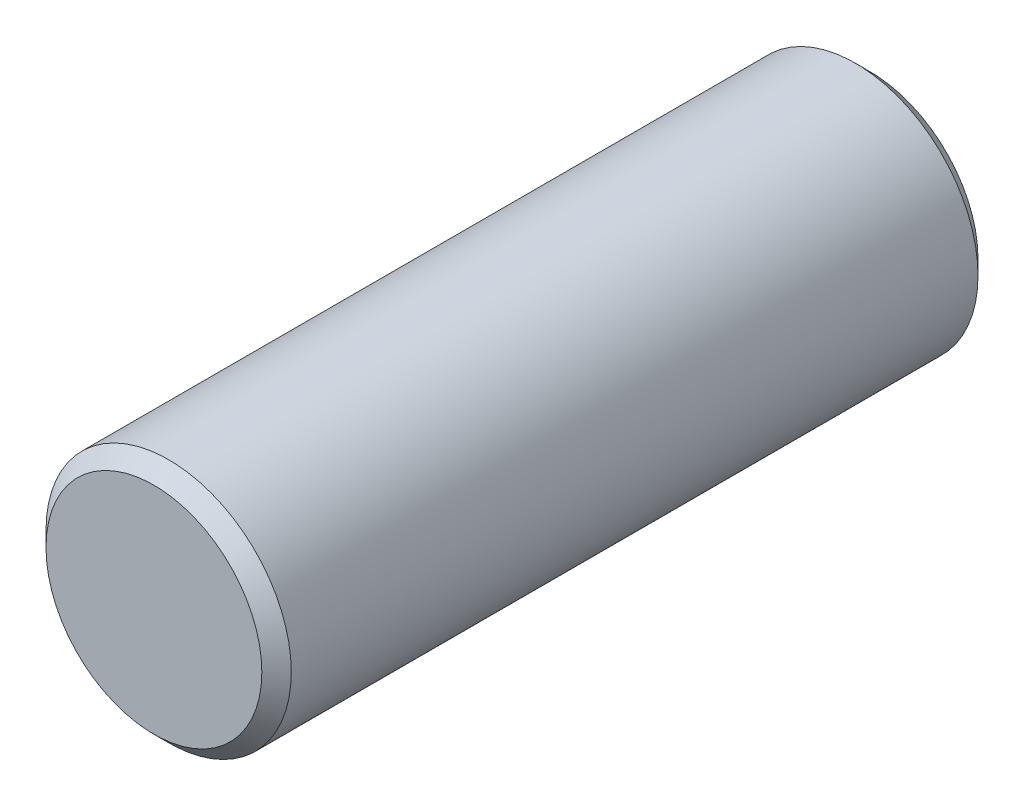
from build123d import *

# Parameters (mm, degrees)
SKIZZE1_R                    = 12.5
BASIS_LINEAR_AUSTRAGEN_DEPTH = 36.5
FASE1_SIZE                   = 1.5


with BuildPart() as part:
    # Skizze1 → Basis-Linear austragen (new, symmetric)
    with BuildSketch(Plane.XY):
        Circle(SKIZZE1_R)
    extrude(amount=BASIS_LINEAR_AUSTRAGEN_DEPTH, both=True)

    # Fase1
    fase1_edges = [part.edges().sort_by_distance(p)[0] for p in [
        (-12.5, 0, -36.5),
        (-12.5, 0, 36.5),
    ]]
    chamfer(fase1_edges, length=FASE1_SIZE)


solid = part.part
